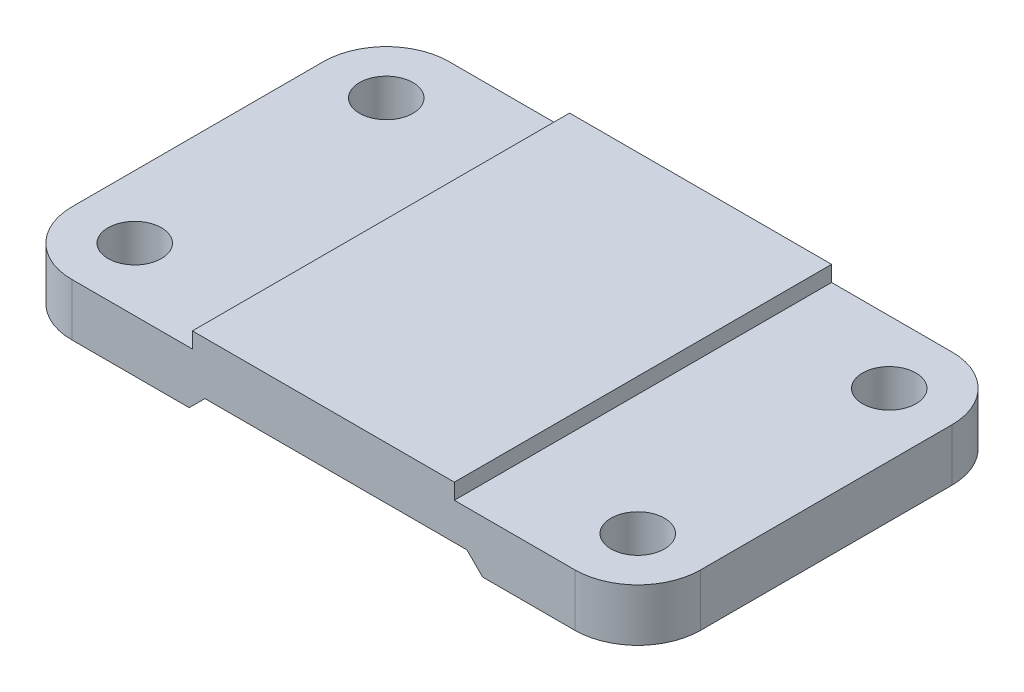
from build123d import *

# Parameters (mm, degrees)
SKETCH1_R           = 5.1
BOSS_EXTRUDE1_DEPTH = 10
SKETCH2_W           = 50
SKETCH2_H           = 72
BOSS_EXTRUDE2_DEPTH = 3
CUT_EXTRUDE1_DEPTH  = 95.620293806


with BuildPart() as part:
    # Sketch1 → Boss-Extrude1 (new body)
    with BuildSketch(Plane(origin=(0, 0, 0), x_dir=(1, 0, 0), z_dir=(0, 1, 0))):
        with BuildLine():
            Line((48, 36), (-48, 36))
            ThreePointArc((-48, 36), (-56.485281374, 32.485281374), (-60, 24))
            Line((-60, 24), (-60, -24))
            ThreePointArc((-60, -24), (-56.485281374, -32.485281374), (-48, -36))
            Line((-48, -36), (48, -36))
            ThreePointArc((48, -36), (56.485281374, -32.485281374), (60, -24))
            Line((60, -24), (60, 24))
            ThreePointArc((60, 24), (56.485281374, 32.485281374), (48, 36))
        make_face()
        with Locations(Location((-48, 24, 0), (0, 0, 270))):
            Circle(SKETCH1_R, mode=Mode.SUBTRACT)
        with Locations(Location((-48, -24, 0), (0, 0, 90))):
            Circle(SKETCH1_R, mode=Mode.SUBTRACT)
        with Locations(Location((48, -24, 0), (0, 0, 270))):
            Circle(SKETCH1_R, mode=Mode.SUBTRACT)
        with Locations(Location((48, 24, 0), (0, 0, 90))):
            Circle(SKETCH1_R, mode=Mode.SUBTRACT)
    extrude(amount=BOSS_EXTRUDE1_DEPTH)

    # Sketch2 → Boss-Extrude2 (add)
    with BuildSketch(Plane(origin=(0, 10, 0), x_dir=(1, 0, 0), z_dir=(0, 1, 0))):
        Rectangle(SKETCH2_W, SKETCH2_H)
    extrude(amount=BOSS_EXTRUDE2_DEPTH)

    # Sketch3 → Cut-Extrude1 (cut, through all)
    with BuildSketch(Plane.XY.offset(36)):
        Polygon((0, 0), (-25.604267378, 0), (-22.604267378, 3), (27.395732622, 3), (30.395732622, 0), align=None)
    extrude(amount=-CUT_EXTRUDE1_DEPTH, mode=Mode.SUBTRACT)


solid = part.part
